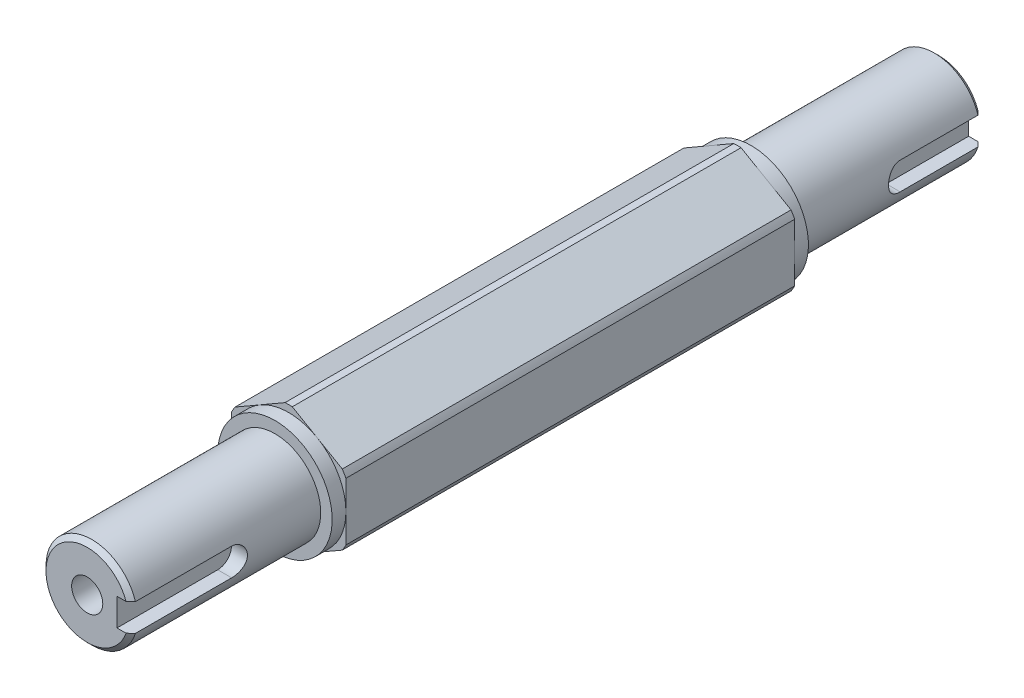
from build123d import *

# Parameters (mm, degrees)
BOSS_EXTRUDE1_DEPTH   = 49
CHAMFER1_SIZE         = 1
M8_TAPPED_HOLE1_D     = 6.8
M8_TAPPED_HOLE1_DEPTH = 19.75
M8_TAPPED_HOLE1_TIP   = 2.042926105
CUT_EXTRUDE1_START    = 10
CUT_EXTRUDE1_DEPTH    = 3.5


with BuildPart() as part:
    # Sketch1 → Boss-Extrude1 (new, symmetric)
    with BuildSketch(Plane.XY):
        with BuildLine():
            ThreePointArc((0.789917583, 13.977697601), (0, 14), (-0.789917583, 13.977697601))
            Line((-0.789917583, 13.977697601), (-11.710082417, 7.672937494))
            ThreePointArc((-11.710082417, 7.672937494), (-12.124355653, 7), (-12.5, 6.304760106))
            Line((-12.5, 6.304760106), (-12.5, -6.304760106))
            ThreePointArc((-12.5, -6.304760106), (-12.124355653, -7), (-11.710082417, -7.672937494))
            Line((-11.710082417, -7.672937494), (-0.789917583, -13.977697601))
            ThreePointArc((-0.789917583, -13.977697601), (0, -14), (0.789917583, -13.977697601))
            Line((0.789917583, -13.977697601), (11.710082417, -7.672937494))
            ThreePointArc((11.710082417, -7.672937494), (12.124355653, -7), (12.5, -6.304760106))
            Line((12.5, -6.304760106), (12.5, 6.304760106))
            ThreePointArc((12.5, 6.304760106), (12.124355653, 7), (11.710082417, 7.672937494))
            Line((11.710082417, 7.672937494), (0.789917583, 13.977697601))
        make_face()
    extrude(amount=BOSS_EXTRUDE1_DEPTH, both=True)

    # Sketch2 → Revolve1 (revolve)
    with BuildSketch(Plane(origin=(0, 0, 0), x_dir=(0, 0, -1), z_dir=(1, 0, 0)), mode=Mode.PRIVATE) as revolve1_sk:
        Polygon((-93, 0), (-93, 10), (-52, 10), (-52, 12.5), (-49, 12.5), (-49, 0), align=None)
        Polygon((52, 10), (93, 10), (93, 0), (49, 0), (49, 12.5), (52, 12.5), align=None)
    revolve(revolve1_sk.sketch.rotate(Axis((0, 0, -70.752525622), (0, 0, 1)), 90), axis=Axis((0, 0, -70.752525622), (0, 0, 1)))

    # Chamfer1
    chamfer1_edges = [part.edges().sort_by_distance(p)[0] for p in [
        (10, 0, 93),
        (10, 0, -93),
    ]]
    chamfer(chamfer1_edges, length=CHAMFER1_SIZE)

    # M8 Tapped Hole1
    with Locations(Plane.XY.offset(93)):
        with Locations((0, 0)):
            Hole(M8_TAPPED_HOLE1_D / 2, depth=M8_TAPPED_HOLE1_DEPTH)
            with Locations((0, 0, -(M8_TAPPED_HOLE1_DEPTH + M8_TAPPED_HOLE1_TIP / 2))):  # 118° drill point
                Cone(0, M8_TAPPED_HOLE1_D / 2, M8_TAPPED_HOLE1_TIP, mode=Mode.SUBTRACT)

    # Sketch4 → Cut-Extrude1 (cut)
    with BuildSketch(Plane(origin=(0, 0, 0), x_dir=(0, 0, -1), z_dir=(1, 0, 0)).offset(CUT_EXTRUDE1_START)):
        with BuildLine():
            Line((-93, -3), (-71, -3))
            ThreePointArc((-71, -3), (-68, 0), (-71, 3))
            Line((-71, 3), (-93, 3))
            ThreePointArc((-93, 3), (-96, 0), (-93, -3))
        make_face()
        with BuildLine():
            Line((93, 3), (75, 3))
            ThreePointArc((75, 3), (72, 0), (75, -3))
            Line((75, -3), (93, -3))
            ThreePointArc((93, -3), (96, 0), (93, 3))
        make_face()
    extrude(amount=-CUT_EXTRUDE1_DEPTH, mode=Mode.SUBTRACT)


solid = part.part
